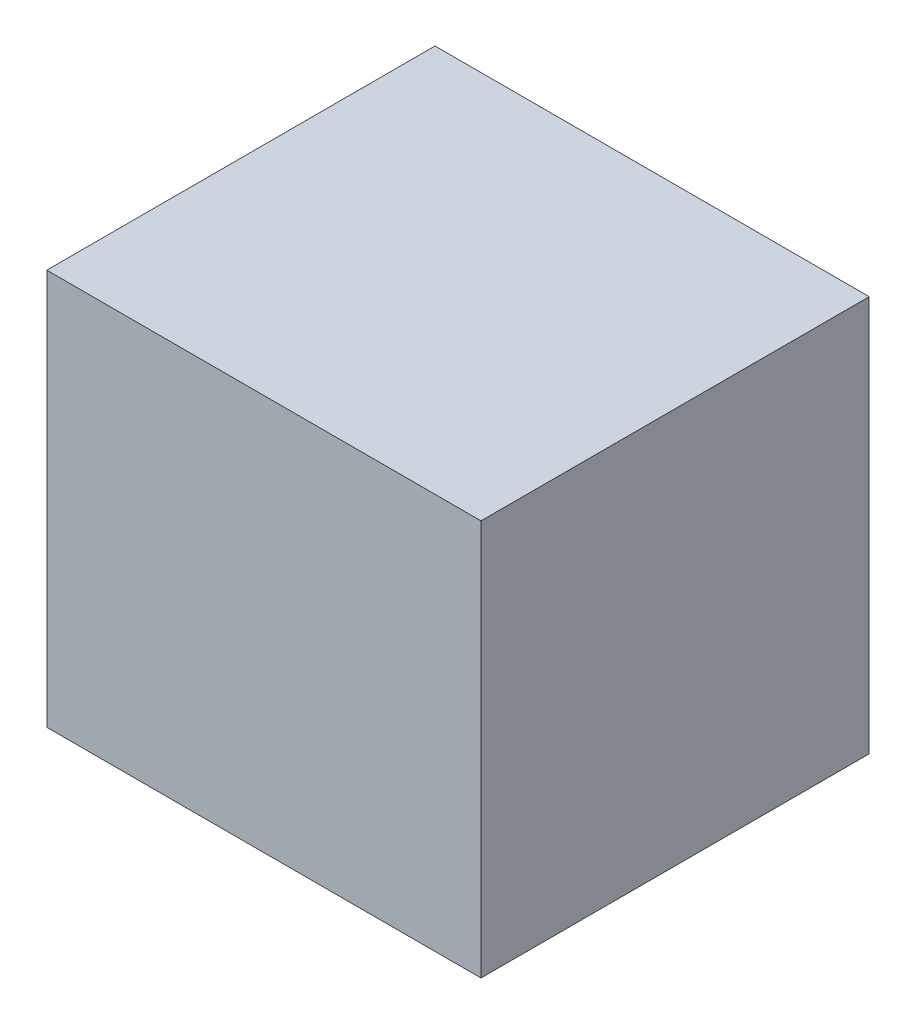
from build123d import *

# Parameters (mm, degrees)
SKETCH1_W           = 17
SKETCH1_H           = 15.5
BOSS_EXTRUDE1_DEPTH = 15.2


with BuildPart() as part:
    # Sketch1 → Boss-Extrude1 (new body)
    with BuildSketch(Plane.XY):
        with Locations((36, 1)):
            Rectangle(SKETCH1_W, SKETCH1_H)
    extrude(amount=BOSS_EXTRUDE1_DEPTH)


solid = part.part
